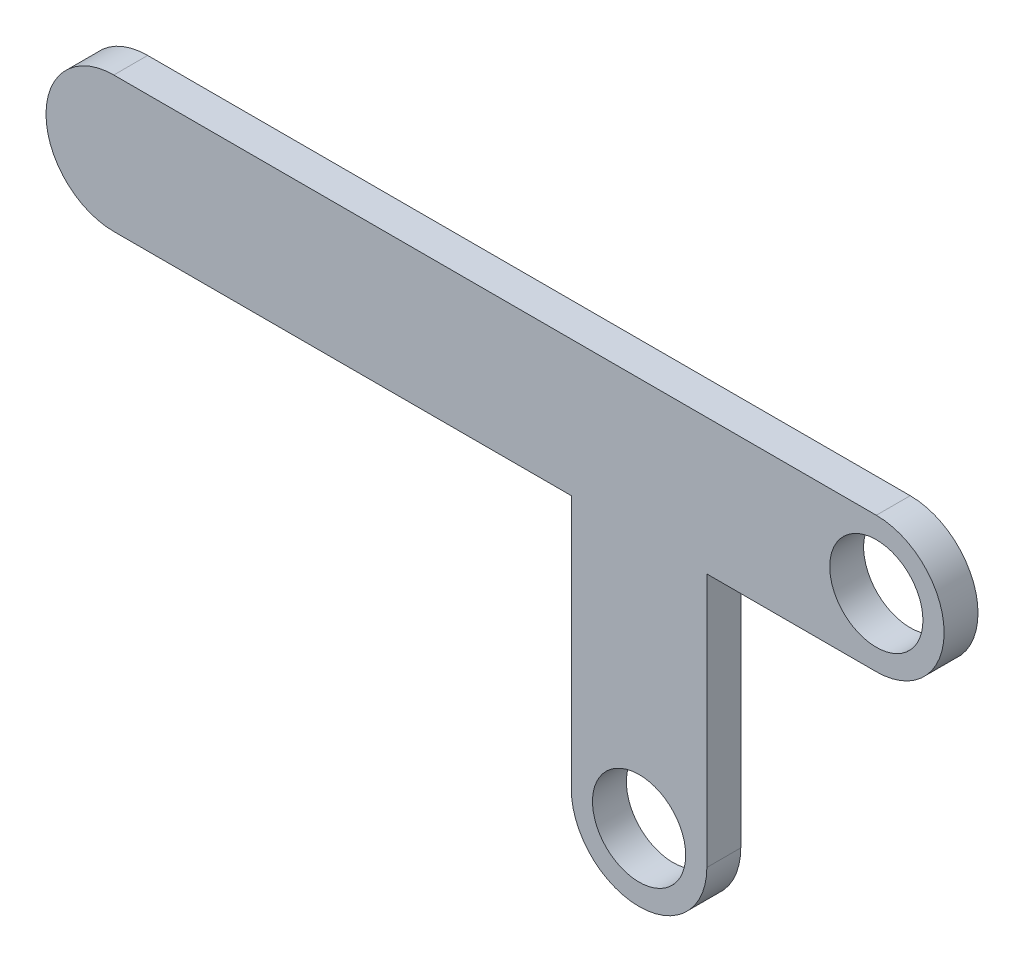
from build123d import *

# Parameters (mm, degrees)
SKETCH1_R           = 2.75
BOSS_EXTRUDE2_DEPTH = 2


with BuildPart() as part:
    # Sketch1 → Boss-Extrude2 (new body)
    with BuildSketch(Plane.XY):
        with BuildLine():
            Line((35, 0), (45, 0))
            ThreePointArc((45, 0), (49, 4), (45, 8))
            Line((45, 8), (0, 8))
            ThreePointArc((0, 8), (-4, 4), (0, 0))
            Line((0, 0), (27, 0))
            Line((27, 0), (27, -15))
            ThreePointArc((27, -15), (31, -19), (35, -15))
            Line((35, -15), (35, 0))
        make_face()
        with Locations((45, 4)):
            Circle(SKETCH1_R, mode=Mode.SUBTRACT)
        with Locations((31, -15)):
            Circle(SKETCH1_R, mode=Mode.SUBTRACT)
    extrude(amount=BOSS_EXTRUDE2_DEPTH)


solid = part.part
